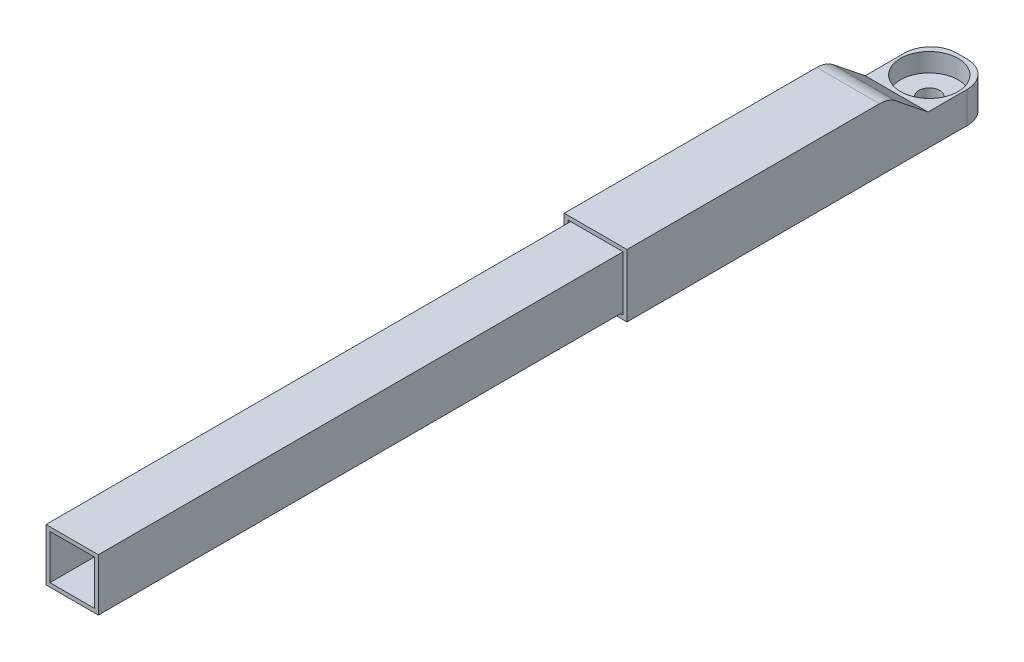
from build123d import *

# Parameters (mm, degrees)
SKETCH1_W           = 20
SKETCH1_H           = 20
SKETCH1_W_2         = 17
SKETCH1_H_2         = 17
BOSS_EXTRUDE1_DEPTH = 300
SKETCH2_W           = 24
SKETCH2_H           = 24
SKETCH2_W_2         = 21
SKETCH2_H_2         = 21
SKETCH2_W_3         = 0.5
SKETCH2_H_3         = 0.5
SKETCH2_W_4         = 16
SKETCH2_H_4         = 16
BOSS_EXTRUDE2_DEPTH = 100
SKETCH3_W           = 24
SKETCH3_H           = 24
BOSS_EXTRUDE3_DEPTH = 5
SKETCH7_W           = 24
SKETCH7_H           = 12
BOSS_EXTRUDE5_DEPTH = 25
FILLET2_R           = 10
SKETCH9_R           = 4
CUT_EXTRUDE1_DEPTH  = 301.479616621
SKETCH9_4_R         = 11
CUT_EXTRUDE2_DEPTH  = 7.1
FILLET3_R           = 10


with BuildPart() as part:
    # Sketch1 → Boss-Extrude1 (new body)
    with BuildSketch(Plane.XY):
        Rectangle(SKETCH1_W, SKETCH1_H)
        Rectangle(SKETCH1_W_2, SKETCH1_H_2, mode=Mode.SUBTRACT)
    extrude(amount=BOSS_EXTRUDE1_DEPTH)


with BuildPart() as body_2:
    # Sketch2 → Boss-Extrude2 (new body)
    # profile 1 of 5: a face of its own
    with BuildSketch(Plane(origin=(0, 0, 0), x_dir=(-1, 0, 0), z_dir=(0, 0, -1))):
        Rectangle(SKETCH2_W, SKETCH2_H)
        Rectangle(SKETCH2_W_2, SKETCH2_H_2, mode=Mode.SUBTRACT)
    # profile 2 of 5: a face of its own
    with BuildSketch(Plane(origin=(0, 0, 0), x_dir=(-1, 0, 0), z_dir=(0, 0, -1))):
        with Locations((-8.25, 0)):
            Rectangle(SKETCH2_W_3, SKETCH2_H_3)
    # profile 3 of 5: a face of its own
    with BuildSketch(Plane(origin=(0, 0, 0), x_dir=(-1, 0, 0), z_dir=(0, 0, -1))):
        with Locations((8.25, 0)):
            Rectangle(SKETCH2_W_3, SKETCH2_H_3)
    # profile 4 of 5: a face of its own
    with BuildSketch(Plane(origin=(0, 0, 0), x_dir=(-1, 0, 0), z_dir=(0, 0, -1))):
        with Locations((0, 8.25)):
            Rectangle(SKETCH2_W_3, SKETCH2_H_3)
    # profile 5 of 5: a face of its own
    with BuildSketch(Plane(origin=(0, 0, 0), x_dir=(-1, 0, 0), z_dir=(0, 0, -1))):
        Rectangle(SKETCH2_W_4, SKETCH2_H_4)
    extrude(amount=-BOSS_EXTRUDE2_DEPTH)

    # Sketch3 → Boss-Extrude3 (add)
    with BuildSketch(Plane(origin=(0, 0, 0), x_dir=(-1, 0, 0), z_dir=(0, 0, -1))):
        Rectangle(SKETCH3_W, SKETCH3_H)
    extrude(amount=-BOSS_EXTRUDE3_DEPTH)

    # Sketch6 → section 0 of loft1
    with BuildSketch(Plane(origin=(0, 0, -15), x_dir=(-1, 0, 0), z_dir=(0, 0, -1)), mode=Mode.PRIVATE) as loft1_s0:
        with BuildLine():
            Line((-12, -12), (12, -12))
            Line((12, -12), (12, 0))
            Line((12, 0), (-12, 0))
            Line((-12, 0), (-12, -12))
        make_face()
    # loft up to a face of the part (loft1)
    loft([loft1_s0.sketch, body_2.faces().sort_by_distance((0, 0, 0))[0]])

    # Sketch7 → Boss-Extrude5 (add)
    with BuildSketch(Plane(origin=(0, 0, -15), x_dir=(-1, 0, 0), z_dir=(0, 0, -1))):
        with Locations((0, -6)):
            Rectangle(SKETCH7_W, SKETCH7_H)
    extrude(amount=BOSS_EXTRUDE5_DEPTH)

    # Fillet2
    fillet2_edges = [body_2.edges().sort_by_distance(p)[0] for p in [
        (-12, -6, -40),
        (12, -6, -40),
    ]]
    fillet(fillet2_edges, radius=FILLET2_R)

    # Sketch9 → Cut-Extrude1 (cut, through all)
    with BuildSketch(Plane(origin=(0, 0, 0), x_dir=(1, 0, 0), z_dir=(0, 1, 0))):
        with Locations(Location((0, 27.5, 0), (0, 0, 270))):
            Circle(SKETCH9_R)
    extrude(amount=-CUT_EXTRUDE1_DEPTH, mode=Mode.SUBTRACT)

    # Sketch9<4> → Cut-Extrude2 (cut)
    with BuildSketch(Plane(origin=(0, 0, 0), x_dir=(1, 0, 0), z_dir=(0, 1, 0))):
        with Locations(Location((0, 27.5, 0), (0, 0, 270))):
            Circle(SKETCH9_4_R)
    extrude(amount=-CUT_EXTRUDE2_DEPTH, mode=Mode.SUBTRACT)

    # Fillet3
    fillet3_edges = [body_2.edges().sort_by_distance(p)[0] for p in [
        (0, 12, 0),
    ]]
    fillet(fillet3_edges, radius=FILLET3_R)


solid = Compound([part.part, body_2.part])
